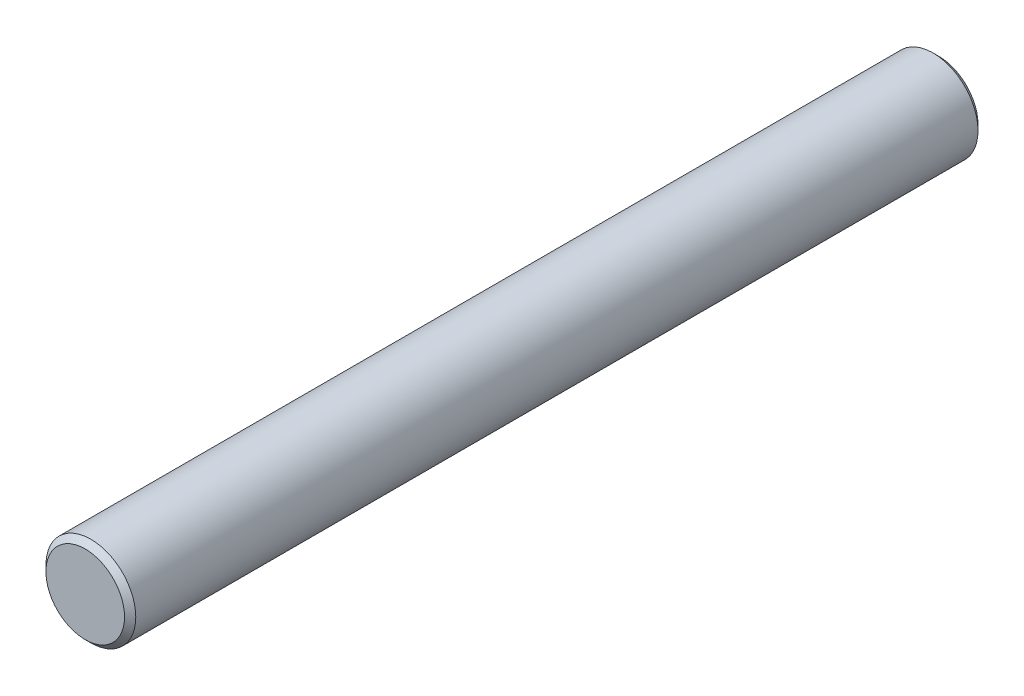
from build123d import *

# Parameters (mm, degrees)
CROQUIS1_R              = 4
SALIENTE_EXTRUIR1_DEPTH = 76
CHAFL_N1_SIZE           = 0.5


with BuildPart() as part:
    # Croquis1 → Saliente-Extruir1 (new body)
    with BuildSketch(Plane.XY):
        Circle(CROQUIS1_R)
    extrude(amount=-SALIENTE_EXTRUIR1_DEPTH)

    # Chaflán1
    chafl_n1_edges = [part.edges().sort_by_distance(p)[0] for p in [
        (-4, 0, 0),
        (-4, 0, -76),
    ]]
    chamfer(chafl_n1_edges, length=CHAFL_N1_SIZE)


solid = part.part
